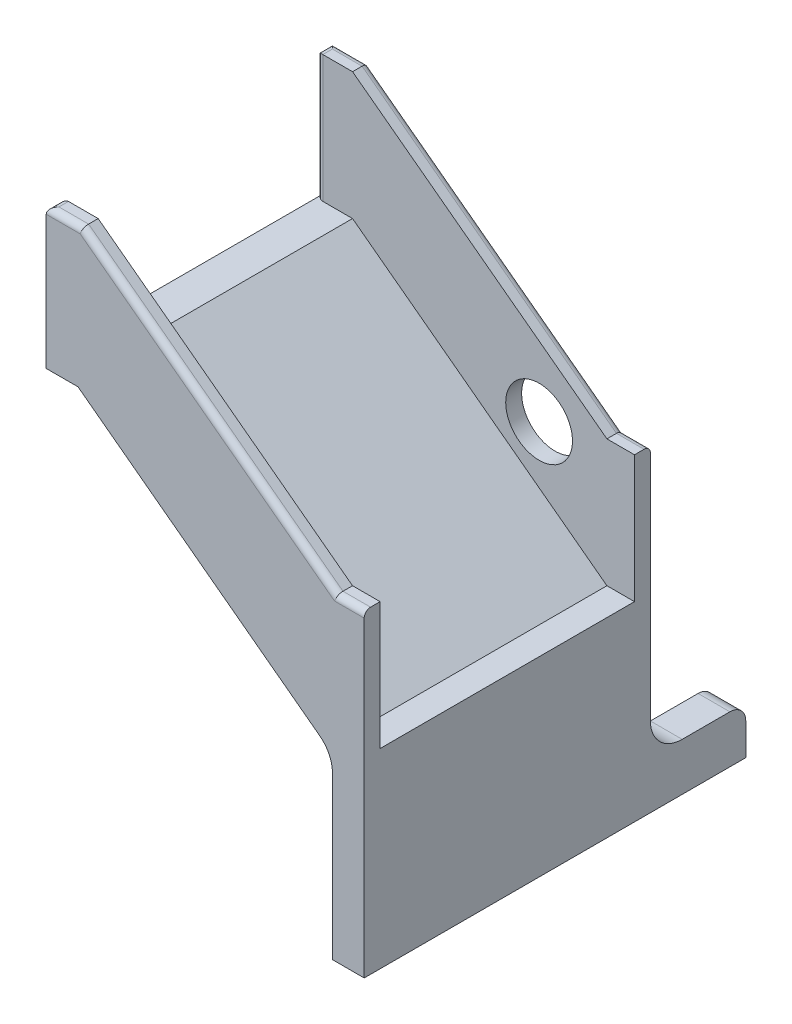
from build123d import *

# Parameters (mm, degrees)
BOSS_EXTRUDE1_DEPTH = 45
BOSS_EXTRUDE2_DEPTH = 5
CUT_EXTRUDE1_REACH  = 148.924
SKETCH3_R           = 10.5
SKETCH5_W           = 20
SKETCH5_H           = 30
BOSS_EXTRUDE3_DEPTH = 10
SKETCH6_R           = 5.087291531
CUT_EXTRUDE2_DEPTH  = 10
SKETCH8_W           = 10
SKETCH8_H           = 56
BOSS_EXTRUDE4_DEPTH = 90
FILLET1_R           = 10
FILLET2_R           = 10
FILLET3_R           = 2
SKETCH9_W           = 10
SKETCH9_H           = 15
BOSS_EXTRUDE5_DEPTH = 30
FILLET4_R           = 10
FILLET5_R           = 5


with BuildPart() as part:
    # Sketch1 → Boss-Extrude1 (new, symmetric)
    with BuildSketch(Plane.XY):
        Polygon((41.677960524, 0), (-38.322039476, 60), (-48.322039476, 60), (-48.322039476, 64), (-36.988706143, 64), (43.011293857, 4), (51.677960524, 4), (51.677960524, 0), align=None)
    extrude(amount=BOSS_EXTRUDE1_DEPTH, both=True)

    # Sketch2 → Boss-Extrude2 (add)
    with BuildSketch(Plane.XY.offset(45)):
        Polygon((-48.322039476, 64), (-48.322039476, 104), (-36.988706143, 104), (43.011293857, 44), (51.677960524, 44), (51.677960524, 4), (43.011293857, 4), (-36.988706143, 64), align=None)
    boss_extrude2 = extrude(amount=-BOSS_EXTRUDE2_DEPTH)

    # Mirror1: Boss-Extrude2 across plane
    add(boss_extrude2.mirror(Plane.XY))

    # Sketch3 → Cut-Extrude1 (cut, up to next)
    with BuildSketch(Plane(origin=(0, 0, -45), x_dir=(-1, 0, 0), z_dir=(0, 0, -1)), mode=Mode.PRIVATE) as cut_extrude1_sk1:
        with Locations((-21.677960524, 38)):
            Circle(SKETCH3_R)
    cut_extrude1_tool1 = extrude(cut_extrude1_sk1.sketch, amount=-CUT_EXTRUDE1_REACH, mode=Mode.PRIVATE) & part.part
    add(cut_extrude1_tool1.solids().sort_by_distance((21.677961, 38, -45))[0], mode=Mode.SUBTRACT)

    # Sketch5 → Boss-Extrude3 (add)
    with BuildSketch(Plane.ZY.offset(48.322039476)):
        with Locations((0, 45)):
            Rectangle(SKETCH5_W, SKETCH5_H)
    extrude(amount=-BOSS_EXTRUDE3_DEPTH)

    # Sketch6 → Cut-Extrude2 (cut)
    with BuildSketch(Plane.ZY.offset(48.322039476)):
        with Locations((0, 44)):
            Circle(SKETCH6_R)
    extrude(amount=-CUT_EXTRUDE2_DEPTH, mode=Mode.SUBTRACT)

    # Sketch8 → Boss-Extrude4 (add)
    with BuildSketch(Plane.XY.offset(45)):
        with Locations((46.677960524, -28)):
            Rectangle(SKETCH8_W, SKETCH8_H)
    extrude(amount=-BOSS_EXTRUDE4_DEPTH)

    # Fillet1
    fillet1_edges = [part.edges().sort_by_distance(p)[0] for p in [
        (-43.322039476, 60, -10),
        (-43.322039476, 60, 10),
    ]]
    fillet(fillet1_edges, radius=FILLET1_R)

    # Fillet2
    fillet2_edges = [part.edges().sort_by_distance(p)[0] for p in [
        (41.677960524, 0, 0),
    ]]
    fillet(fillet2_edges, radius=FILLET2_R)

    # Fillet3
    fillet3_edges = [part.edges().sort_by_distance(p)[0] for p in [
        (-48.322039476, 84, 40),
        (-48.322039476, 104, 42.5),
        (47.344627191, 44, 45),
        (3.011293857, 74, 45),
        (-42.655372809, 104, 45),
        (47.344627191, 44, -45),
        (3.011293857, 74, -45),
        (-42.655372809, 104, -45),
        (-48.322039476, 104, -42.5),
        (-48.322039476, 84, -40),
    ]]
    fillet(fillet3_edges, radius=FILLET3_R)

    # Sketch9 → Boss-Extrude5 (add)
    with BuildSketch(Plane(origin=(0, 0, -45), x_dir=(-1, 0, 0), z_dir=(0, 0, -1))):
        with Locations((-46.677960524, -48.5)):
            Rectangle(SKETCH9_W, SKETCH9_H)
    extrude(amount=BOSS_EXTRUDE5_DEPTH)

    # Fillet4
    fillet4_edges = [part.edges().sort_by_distance(p)[0] for p in [
        (46.677960524, -41, -45),
    ]]
    fillet(fillet4_edges, radius=FILLET4_R)

    # Fillet5
    fillet5_edges = [part.edges().sort_by_distance(p)[0] for p in [
        (46.677960524, -41, -75),
    ]]
    fillet(fillet5_edges, radius=FILLET5_R)


solid = part.part
